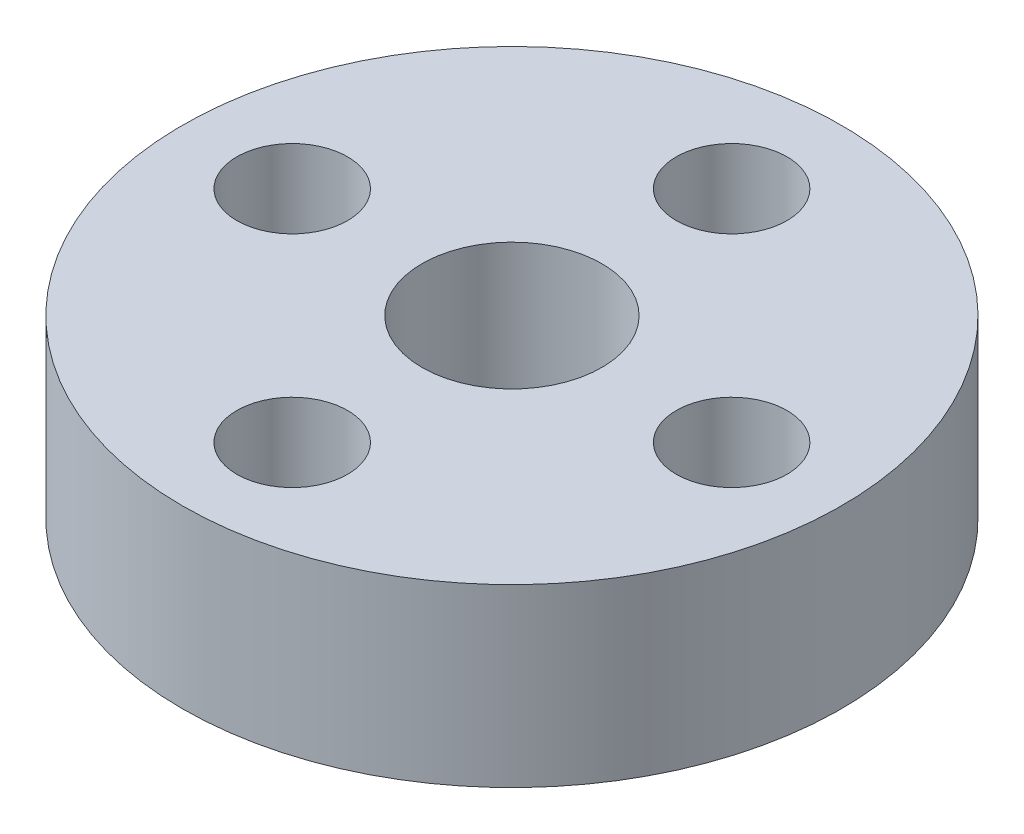
from build123d import *

# Parameters (mm, degrees)
SKETCH1_R           = 9.525
SKETCH1_R_2         = 1.6
SKETCH1_R_3         = 2.6
BOSS_EXTRUDE1_DEPTH = 5.08


with BuildPart() as part:
    # Sketch1 → Boss-Extrude1 (new body)
    with BuildSketch(Plane(origin=(0, 0, 0), x_dir=(1, 0, 0), z_dir=(0, 1, 0))):
        with Locations(Location((0, 0, 0), (0, 0, 270))):
            Circle(SKETCH1_R)
        with Locations(Location((0, 6.35, 0), (0, 0, 270))):
            Circle(SKETCH1_R_2, mode=Mode.SUBTRACT)
        with Locations(Location((6.35, 0, 0), (0, 0, 270))):
            Circle(SKETCH1_R_2, mode=Mode.SUBTRACT)
        with Locations(Location((0, -6.35, 0), (0, 0, 270))):
            Circle(SKETCH1_R_2, mode=Mode.SUBTRACT)
        with Locations(Location((-6.35, 0, 0), (0, 0, 270))):
            Circle(SKETCH1_R_2, mode=Mode.SUBTRACT)
        with Locations(Location((0, 0, 0), (0, 0, 270))):
            Circle(SKETCH1_R_3, mode=Mode.SUBTRACT)
    extrude(amount=BOSS_EXTRUDE1_DEPTH)


solid = part.part
